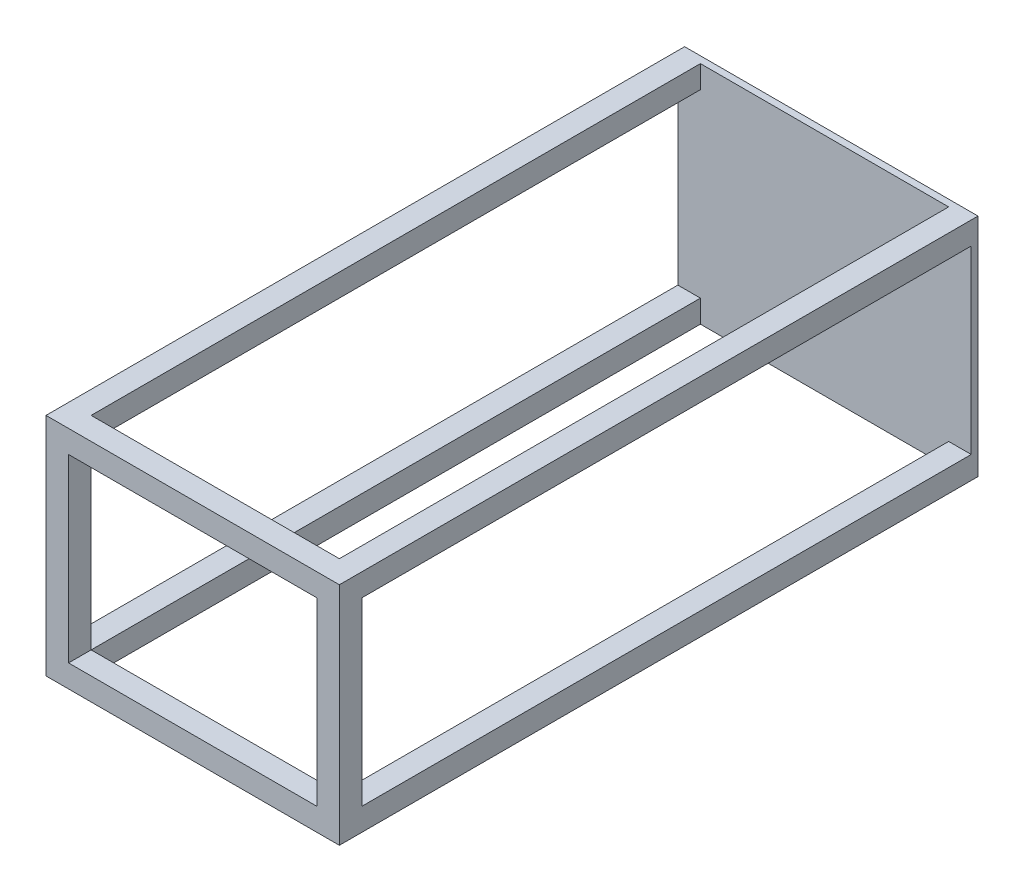
from build123d import *

# Parameters (mm, degrees)
SKETCH1_W           = 130
SKETCH1_H           = 100
BOSS_EXTRUDE1_DEPTH = 3
SKETCH2_W           = 10
SKETCH2_H           = 10
SKETCH2_W_2         = 7
SKETCH2_H_2         = 7
BOSS_EXTRUDE2_DEPTH = 280
SKETCH3_W           = 10
SKETCH3_H           = 10
SKETCH3_W_2         = 7
SKETCH3_H_2         = 7
BOSS_EXTRUDE3_DEPTH = 112
SKETCH4_W           = 10
SKETCH4_H           = 10
SKETCH4_W_2         = 7
SKETCH4_H_2         = 7
BOSS_EXTRUDE4_DEPTH = 112
SKETCH5_W           = 10
SKETCH5_H           = 10
SKETCH5_W_2         = 7
SKETCH5_H_2         = 7
BOSS_EXTRUDE5_DEPTH = 82
SKETCH6_W           = 10
SKETCH6_H           = 10
SKETCH6_W_2         = 7
SKETCH6_H_2         = 7
BOSS_EXTRUDE6_DEPTH = 82
SKETCH7_W           = 7
SKETCH7_H           = 7
SKETCH7_W_2         = 6
BOSS_EXTRUDE7_DEPTH = 0.1


with BuildPart() as part:
    # Sketch1 → Boss-Extrude1 (new body)
    with BuildSketch(Plane.XY):
        with Locations((65, 50)):
            Rectangle(SKETCH1_W, SKETCH1_H)
    extrude(amount=BOSS_EXTRUDE1_DEPTH)

    # Sketch2 → Boss-Extrude2 (add)
    # profile 1 of 4: a face of its own
    with BuildSketch(Plane.XY.offset(3)):
        with Locations((125, 95)):
            Rectangle(SKETCH2_W, SKETCH2_H)
        with Locations((125.5, 95.5)):
            Rectangle(SKETCH2_W_2, SKETCH2_H_2, mode=Mode.SUBTRACT)
    # profile 2 of 4: a face of its own
    with BuildSketch(Plane.XY.offset(3)):
        with Locations((125, 5)):
            Rectangle(SKETCH2_W, SKETCH2_H)
        with Locations((125.5, 4.5)):
            Rectangle(SKETCH2_W_2, SKETCH2_H_2, mode=Mode.SUBTRACT)
    # profile 3 of 4: a face of its own
    with BuildSketch(Plane.XY.offset(3)):
        with Locations((5, 5)):
            Rectangle(SKETCH2_W, SKETCH2_H)
        with Locations((5.5, 4.5)):
            Rectangle(SKETCH2_W_2, SKETCH2_H_2, mode=Mode.SUBTRACT)
    # profile 4 of 4: a face of its own
    with BuildSketch(Plane.XY.offset(3)):
        with Locations((5, 95)):
            Rectangle(SKETCH2_W, SKETCH2_H)
        with Locations((4.5, 95.5)):
            Rectangle(SKETCH2_W_2, SKETCH2_H_2, mode=Mode.SUBTRACT)
    extrude(amount=BOSS_EXTRUDE2_DEPTH)

    # Sketch3 → Boss-Extrude3 (add)
    with BuildSketch(Plane.ZY.offset(-120)):
        with Locations((278, 95)):
            Rectangle(SKETCH3_W, SKETCH3_H)
        with Locations((278, 95)):
            Rectangle(SKETCH3_W_2, SKETCH3_H_2, mode=Mode.SUBTRACT)
    extrude(amount=BOSS_EXTRUDE3_DEPTH)

    # Sketch4 → Boss-Extrude4 (add)
    with BuildSketch(Plane.ZY.offset(-120)):
        with Locations((278, 5)):
            Rectangle(SKETCH4_W, SKETCH4_H)
        with Locations((278, 5)):
            Rectangle(SKETCH4_W_2, SKETCH4_H_2, mode=Mode.SUBTRACT)
    extrude(amount=BOSS_EXTRUDE4_DEPTH)

    # Sketch5 → Boss-Extrude5 (add)
    with BuildSketch(Plane(origin=(0, 10, 0), x_dir=(1, 0, 0), z_dir=(0, 1, 0))):
        with Locations((125, -278)):
            Rectangle(SKETCH5_W, SKETCH5_H)
        with Locations((125, -278)):
            Rectangle(SKETCH5_W_2, SKETCH5_H_2, mode=Mode.SUBTRACT)
    extrude(amount=BOSS_EXTRUDE5_DEPTH)

    # Sketch6 → Boss-Extrude6 (add)
    with BuildSketch(Plane.XZ.offset(-90)):
        with Locations((5, 278)):
            Rectangle(SKETCH6_W, SKETCH6_H)
        with Locations((5, 278)):
            Rectangle(SKETCH6_W_2, SKETCH6_H_2, mode=Mode.SUBTRACT)
    extrude(amount=BOSS_EXTRUDE6_DEPTH)

    # Sketch7 → Boss-Extrude7 (add)
    with BuildSketch(Plane.XY.offset(283)):
        with Locations((4.5, 95.5)):
            Rectangle(SKETCH7_W, SKETCH7_H)
        with Locations((125.5, 95.5)):
            Rectangle(SKETCH7_W, SKETCH7_H)
        with Locations((125.5, 4.5)):
            Rectangle(SKETCH7_W, SKETCH7_H)
        with Locations((5, 4.5)):
            Rectangle(SKETCH7_W_2, SKETCH7_H)
    extrude(amount=-BOSS_EXTRUDE7_DEPTH)


solid = part.part
